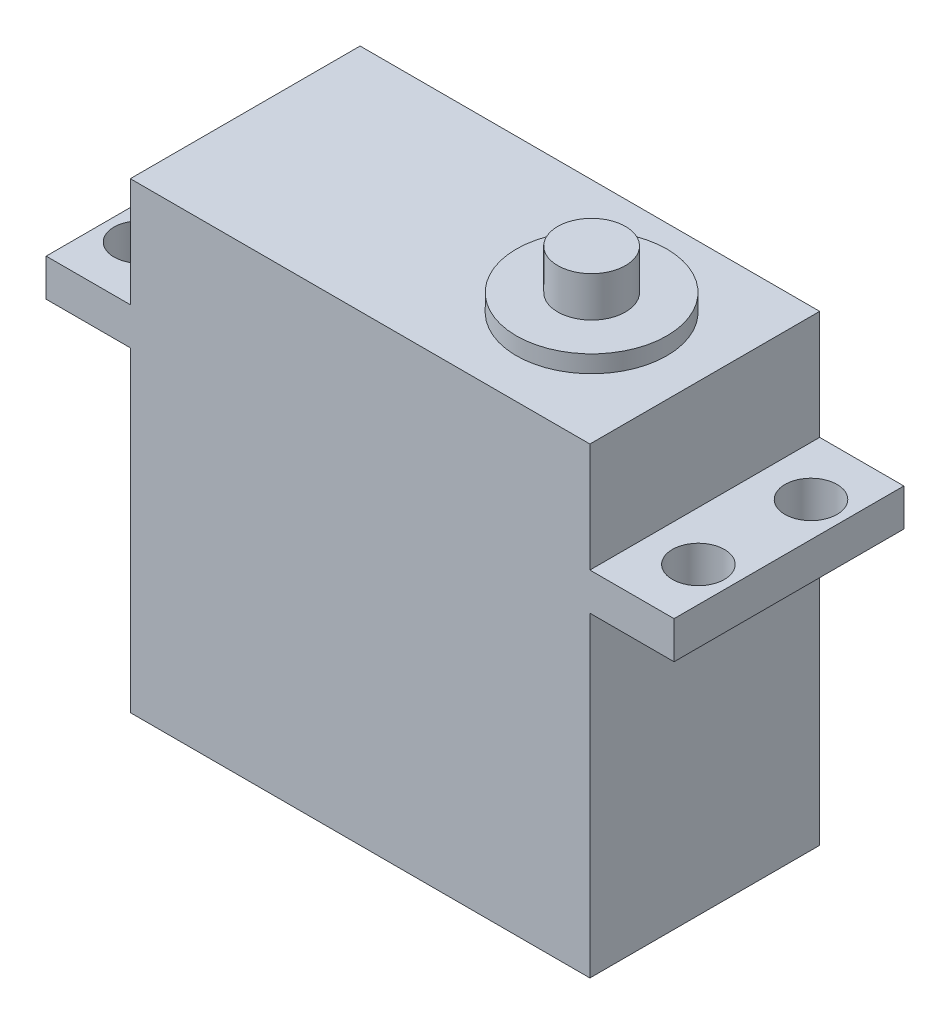
from build123d import *

# Parameters (mm, degrees)
BOSS_EXTRUDE1_DEPTH = 20
SKETCH2_R           = 2.264817621
CUT_EXTRUDE1_DEPTH  = 3.25
SKETCH3_R           = 2.95
BOSS_EXTRUDE2_DEPTH = 5
SKETCH4_R           = 6.55
BOSS_EXTRUDE3_DEPTH = 1.5


with BuildPart() as part:
    # Sketch1 → Boss-Extrude1 (new body)
    with BuildSketch(Plane.XY):
        Polygon((0, 0), (40, 0), (40, 27.5), (47.325, 27.5), (47.325, 30.75), (40, 30.75), (40, 40.25), (0, 40.25), (0, 30.75), (-7.325, 30.75), (-7.325, 27.5), (0, 27.5), align=None)
    extrude(amount=BOSS_EXTRUDE1_DEPTH)

    # Sketch2 → Cut-Extrude1 (cut)
    with BuildSketch(Plane(origin=(0, 30.75, 0), x_dir=(1, 0, 0), z_dir=(0, 1, 0))):
        with Locations(Location((-4.3, -5.055444694, 0), (0, 0, 270))):
            Circle(SKETCH2_R)
        with Locations(Location((-4.3, -14.855444694, 0), (0, 0, 270))):
            Circle(SKETCH2_R)
        with Locations(Location((44.3, -14.855444694, 0), (0, 0, 270))):
            Circle(SKETCH2_R)
        with Locations(Location((44.3, -5.055444694, 0), (0, 0, 270))):
            Circle(SKETCH2_R)
    extrude(amount=-CUT_EXTRUDE1_DEPTH, mode=Mode.SUBTRACT)

    # Sketch3 → Boss-Extrude2 (add)
    with BuildSketch(Plane(origin=(0, 40.25, 0), x_dir=(1, 0, 0), z_dir=(0, 1, 0))):
        with Locations((30.15, -10)):
            Circle(SKETCH3_R)
    extrude(amount=BOSS_EXTRUDE2_DEPTH)

    # Sketch4 → Boss-Extrude3 (add)
    with BuildSketch(Plane(origin=(0, 40.25, 0), x_dir=(1, 0, 0), z_dir=(0, 1, 0))):
        with Locations((30.15, -10)):
            Circle(SKETCH4_R)
    extrude(amount=BOSS_EXTRUDE3_DEPTH)


solid = part.part
